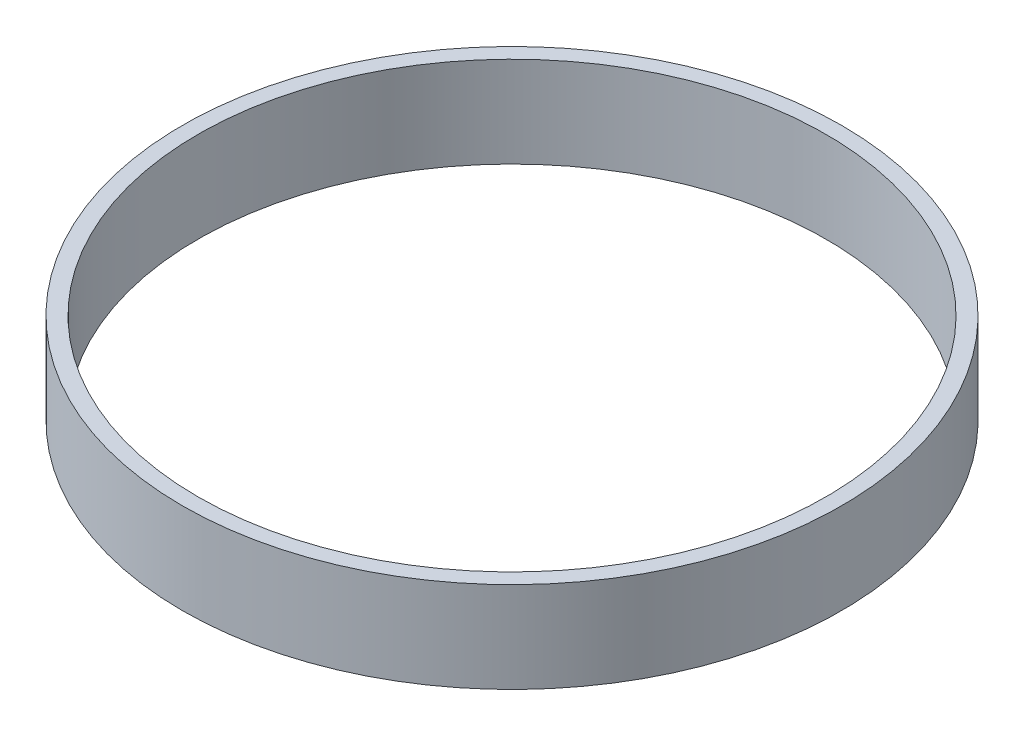
from build123d import *

# Parameters (mm, degrees)
SKETCH1_R           = 25.405
SKETCH1_R_2         = 24.205
BOSS_EXTRUDE1_DEPTH = 7


with BuildPart() as part:
    # Sketch1 → Boss-Extrude1 (new body)
    with BuildSketch(Plane(origin=(0, 0, 0), x_dir=(1, 0, 0), z_dir=(0, 1, 0))):
        with Locations(Location((0, 0, 0), (0, 0, 270))):
            Circle(SKETCH1_R)
        with Locations(Location((0, 0, 0), (0, 0, 270))):
            Circle(SKETCH1_R_2, mode=Mode.SUBTRACT)
    extrude(amount=BOSS_EXTRUDE1_DEPTH)


solid = part.part
